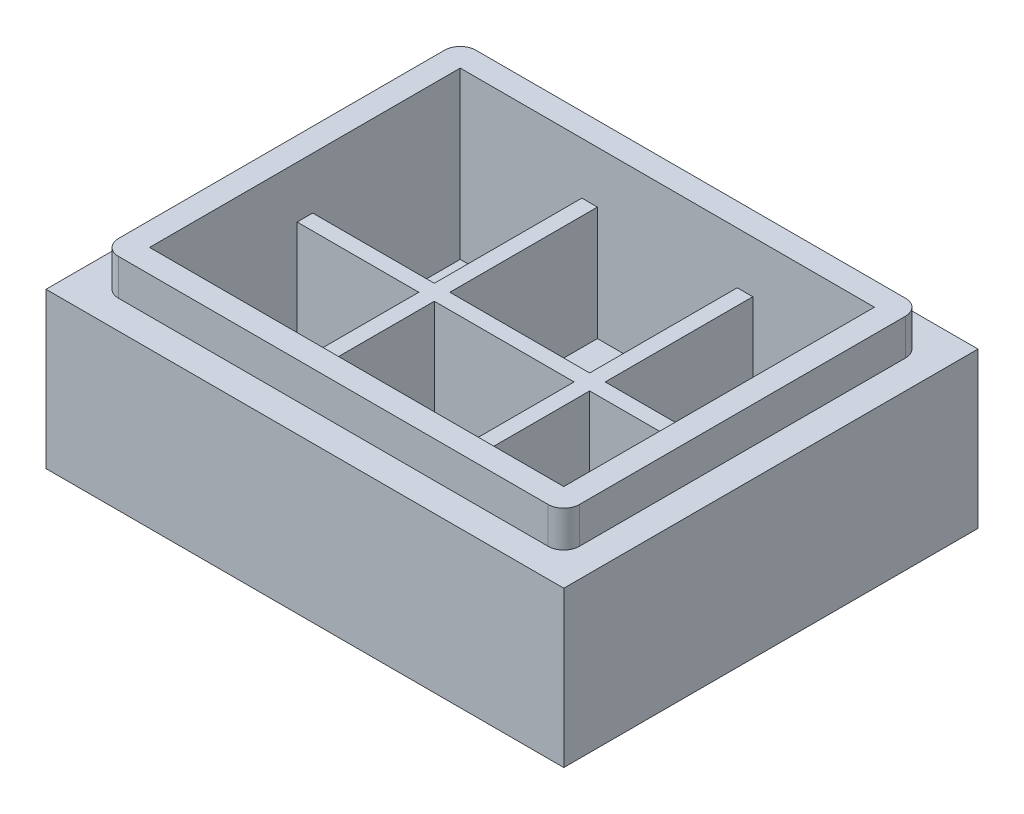
from build123d import *

# Parameters (mm, degrees)
SKETCH1_W           = 100
SKETCH1_H           = 80
BOSS_EXTRUDE1_DEPTH = 30
SKETCH2_W           = 23.5
SKETCH2_H           = 28.5
SKETCH2_W_2         = 27
CUT_EXTRUDE1_DEPTH  = 25
SKETCH3_W           = 80
SKETCH3_H           = 60
CUT_EXTRUDE2_DEPTH  = 3
SKETCH5_W           = 89
SKETCH5_H           = 69
SKETCH5_W_2         = 80
SKETCH5_H_2         = 60
BOSS_EXTRUDE2_DEPTH = 7
FILLET1_R           = 3


with BuildPart() as part:
    # Sketch1 → Boss-Extrude1 (new body)
    with BuildSketch(Plane(origin=(0, 0, 0), x_dir=(1, 0, 0), z_dir=(0, 1, 0))):
        Rectangle(SKETCH1_W, SKETCH1_H)
    extrude(amount=BOSS_EXTRUDE1_DEPTH)

    # Sketch2 → Cut-Extrude1 (cut)
    with BuildSketch(Plane(origin=(0, 30, 0), x_dir=(1, 0, 0), z_dir=(0, 1, 0))):
        with Locations((-28.25, 15.75)):
            Rectangle(SKETCH2_W, SKETCH2_H)
        with Locations((0, 15.75)):
            Rectangle(SKETCH2_W_2, SKETCH2_H)
        with Locations((28.25, 15.75)):
            Rectangle(SKETCH2_W, SKETCH2_H)
        with Locations((28.25, -15.75)):
            Rectangle(SKETCH2_W, SKETCH2_H)
        with Locations((0, -15.75)):
            Rectangle(SKETCH2_W_2, SKETCH2_H)
        with Locations((-28.25, -15.75)):
            Rectangle(SKETCH2_W, SKETCH2_H)
    extrude(amount=-CUT_EXTRUDE1_DEPTH, mode=Mode.SUBTRACT)

    # Sketch3 → Cut-Extrude2 (cut)
    with BuildSketch(Plane(origin=(0, 30, 0), x_dir=(1, 0, 0), z_dir=(0, 1, 0))):
        Rectangle(SKETCH3_W, SKETCH3_H)
    extrude(amount=-CUT_EXTRUDE2_DEPTH, mode=Mode.SUBTRACT)

    # Sketch5 → Boss-Extrude2 (add)
    with BuildSketch(Plane(origin=(0, 30, 0), x_dir=(1, 0, 0), z_dir=(0, 1, 0))):
        Rectangle(SKETCH5_W, SKETCH5_H)
        Rectangle(SKETCH5_W_2, SKETCH5_H_2, mode=Mode.SUBTRACT)
    extrude(amount=BOSS_EXTRUDE2_DEPTH)

    # Fillet1
    fillet1_edges = [part.edges().sort_by_distance(p)[0] for p in [
        (-44.5, 33.5, -34.5),
        (-44.5, 33.5, 34.5),
        (44.5, 33.5, 34.5),
        (44.5, 33.5, -34.5),
    ]]
    fillet(fillet1_edges, radius=FILLET1_R)


solid = part.part
